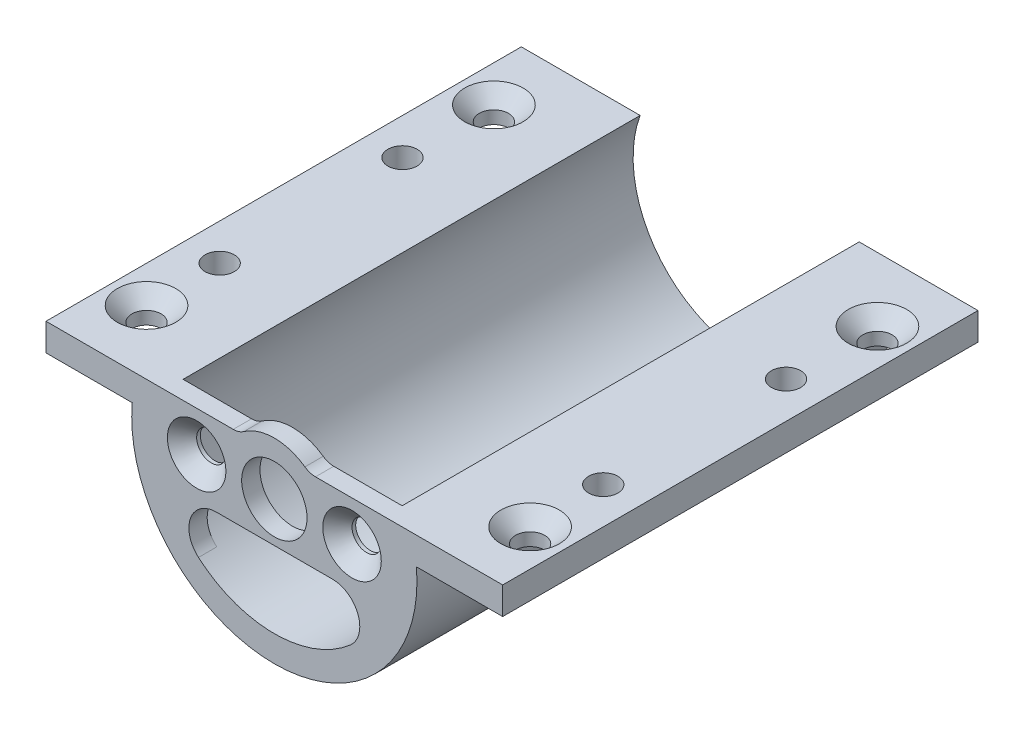
from build123d import *

# Parameters (mm, degrees)
BOSS_EXTRUDE1_DEPTH = 52
SKETCH3_R           = 3.575
BOSS_EXTRUDE2_DEPTH = 2
FILLET2_R           = 2
HOLE1_D             = 3.2
HOLE1_CSINK_D       = 6.4
HOLE1_CSINK_ANGLE   = 90
HOLE2_D             = 3.2
HOLE3_D             = 3.2
HOLE3_CSINK_D       = 6.4
HOLE3_CSINK_ANGLE   = 90
FILLET1_R           = 3


with BuildPart() as part:
    # Sketch1 → Boss-Extrude1 (new body)
    with BuildSketch(Plane.XY):
        with BuildLine():
            ThreePointArc((14.981080915, 4.360756827), (0, -15.602851838), (-14.981080915, 4.360756827))
            Line((-14.981080915, 4.360756827), (-11.981080915, 4.360756827))
            ThreePointArc((-11.981080915, 4.360756827), (0, -12.75), (11.981080915, 4.360756827))
            Line((11.981080915, 4.360756827), (14.981080915, 4.360756827))
        make_face()
        with BuildLine():
            ThreePointArc((-15.543401376, 1.360756827), (-15.335775324, 2.874540085), (-14.981080915, 4.360756827))
            Line((-14.981080915, 4.360756827), (-24.981080915, 4.360756827))
            Line((-24.981080915, 4.360756827), (-24.981080915, 1.360756827))
            Line((-24.981080915, 1.360756827), (-15.543401376, 1.360756827))
        make_face()
        with BuildLine():
            Line((24.981080915, 4.360756827), (14.981080915, 4.360756827))
            ThreePointArc((14.981080915, 4.360756827), (15.335775324, 2.874540085), (15.543401376, 1.360756827))
            Line((15.543401376, 1.360756827), (24.981080915, 1.360756827))
            Line((24.981080915, 1.360756827), (24.981080915, 4.360756827))
        make_face()
    extrude(amount=-BOSS_EXTRUDE1_DEPTH)

    # Sketch3 → Boss-Extrude2 (add)
    with BuildSketch(Plane.XY):
        with BuildLine():
            Line((-3.809974466, 4.360756827), (-11.981080915, 4.360756827))
            ThreePointArc((-11.981080915, 4.360756827), (-12.749982881, -0.020893346), (-11.966724698, -4.4))
            Line((-11.966724698, -4.4), (11.966724698, -4.4))
            ThreePointArc((11.966724698, -4.4), (12.749982881, -0.020893346), (11.981080915, 4.360756827))
            Line((11.981080915, 4.360756827), (3.809974466, 4.360756827))
            ThreePointArc((3.809974466, 4.360756827), (0, 5.790691284), (-3.809974466, 4.360756827))
        make_face()
        Circle(SKETCH3_R, mode=Mode.SUBTRACT)
    extrude(amount=-BOSS_EXTRUDE2_DEPTH)

    # Fillet2
    fillet2_edges = [part.edges().sort_by_distance(p)[0] for p in [
        (-3.809974466, 4.360756827, -1),
        (3.809974466, 4.360756827, -1),
    ]]
    fillet(fillet2_edges, radius=FILLET2_R)

    # Hole1 (through all)
    with Locations(Plane(origin=(-8.5, -0.019621586, 0), x_dir=(1, 0, 0), z_dir=(0, 0, 1))):
        with Locations((0, 0), (17, 0)):
            CounterSinkHole(HOLE1_D / 2, HOLE1_CSINK_D / 2, counter_sink_angle=HOLE1_CSINK_ANGLE)

    # Hole2 (through all)
    with Locations(Plane(origin=(-20.981080915, 4.360756827, -35), x_dir=(1, 0, 0), z_dir=(0, 1, 0))):
        with Locations((0, 0), (0, -20), (41.96216183, -20), (41.96216183, 0)):
            Hole(HOLE2_D / 2)

    # Hole3 (through all)
    with Locations(Plane(origin=(-20.981080915, 4.360756827, -7), x_dir=(1, 0, 0), z_dir=(0, 1, 0))):
        with Locations((0, 0), (0, 38), (41.96216183, 38), (41.96216183, 0)):
            CounterSinkHole(HOLE3_D / 2, HOLE3_CSINK_D / 2, counter_sink_angle=HOLE3_CSINK_ANGLE)

    # Fillet1
    fillet1_edges = [part.edges().sort_by_distance(p)[0] for p in [
        (11.966724698, -4.4, -1),
        (-11.966724698, -4.4, -1),
    ]]
    fillet(fillet1_edges, radius=FILLET1_R)


solid = part.part
